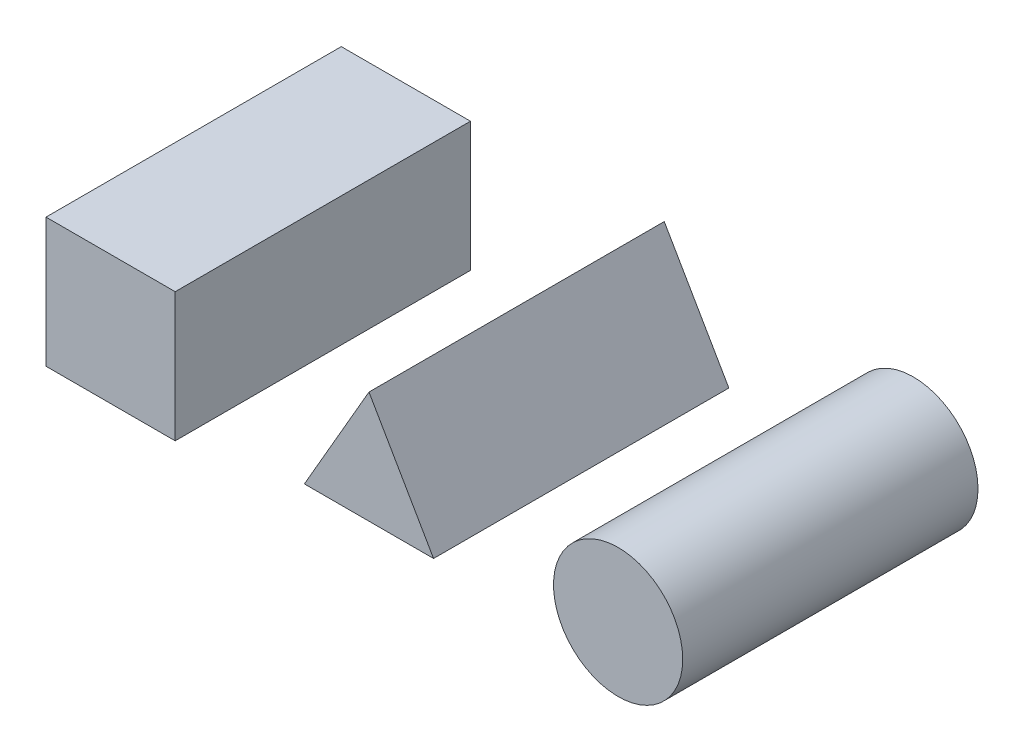
from build123d import *

# Parameters (mm, degrees)
SKETCH1_R             = 17.5
BOSS_EXTRUDE1_DEPTH   = 80
BOSS_EXTRUDE1_2_DEPTH = 80
SKETCH1_W             = 35
SKETCH1_H             = 35
BOSS_EXTRUDE1_3_DEPTH = 80


with BuildPart() as part:
    # Sketch1 → Boss-Extrude1 (new body)
    with BuildSketch(Plane.XY):
        with Locations((67.5, 0)):
            Circle(SKETCH1_R)
    extrude(amount=BOSS_EXTRUDE1_DEPTH)


with BuildPart() as body_2:
    # Sketch1 → Boss-Extrude1 2 (new body)
    with BuildSketch(Plane.XY):
        Polygon((-17.5, -10.103629711), (0, 20.207259422), (17.5, -10.103629711), align=None)
    extrude(amount=BOSS_EXTRUDE1_2_DEPTH)


with BuildPart() as body_3:
    # Sketch1 → Boss-Extrude1 3 (new body)
    with BuildSketch(Plane.XY):
        with Locations((-70, 0)):
            Rectangle(SKETCH1_W, SKETCH1_H)
    extrude(amount=BOSS_EXTRUDE1_3_DEPTH)


solid = Compound([part.part, body_2.part, body_3.part])
